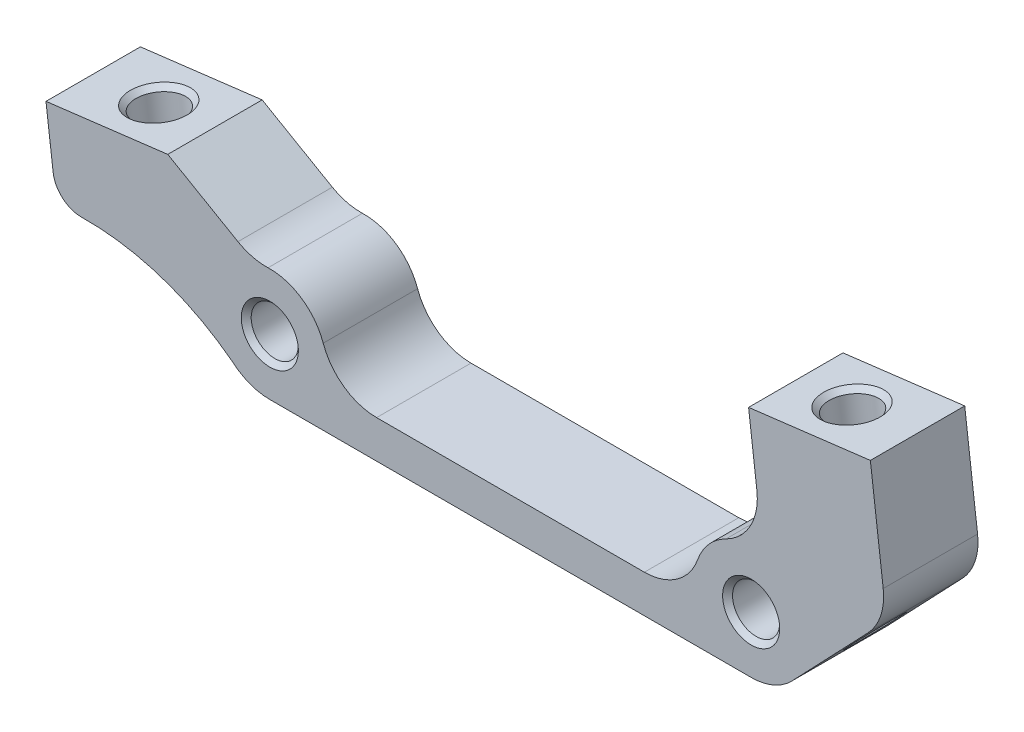
from build123d import *

# Parameters (mm, degrees)
SKETCH_1_R                  = 2.5
EXTRUDE_1_DEPTH             = 10
HOLE_WIZARD_M61_AT_2_COUNT  = 2
HOLE_WIZARD_M61_AT_2_PITCH  = 51
HOLE_WIZARD_M62_D           = 5
HOLE_WIZARD_M62_CSINK_D     = 6.05
HOLE_WIZARD_M62_CSINK_ANGLE = 90


with BuildPart() as part:
    # Эскиз1 → Бобышка-Вытянуть1 (new body)
    with BuildSketch(Plane.XY):
        with BuildLine():
            Line((130.883213409, -0.667537052), (132.243357005, -11.745017689))
            ThreePointArc((132.243357005, -11.745017689), (131.983826113, -14.362626415), (130.629567818, -16.617668809))
            Line((130.629567818, -16.617668809), (122.596022679, -25.039275591))
            ThreePointArc((122.596022679, -25.039275591), (120.615825879, -26.413663696), (118.254534957, -26.897840532))
            Line((118.254534957, -26.897840532), (67.254534957, -26.897840532))
            ThreePointArc((67.254534957, -26.897840532), (65.137379079, -26.511898867), (63.292589424, -25.403724196))
            ThreePointArc((63.292589424, -25.403724196), (55.75092202, -21.419041585), (47.318028666, -20.138123004))
            ThreePointArc((47.318028666, -20.138123004), (45.29848634, -19.402158499), (44.289626193, -17.504160563))
            Line((44.289626193, -17.504160563), (43.539152064, -11.392039271))
            Line((43.539152064, -11.392039271), (56.442252036, -9.807737807))
            Line((56.442252036, -9.807737807), (63.876575818, -14.099946644))
            ThreePointArc((63.876575818, -14.099946644), (65.415135622, -14.723089071), (67.065555387, -14.900817376))
            ThreePointArc((67.065555387, -14.900817376), (70.641046717, -15.944908259), (72.911389206, -18.897840532))
            ThreePointArc((72.911389206, -18.897840532), (75.10414184, -21.796820017), (78.568243456, -22.897840532))
            Line((78.568243456, -22.897840532), (106.940826458, -22.897840532))
            ThreePointArc((106.940826458, -22.897840532), (110.404928073, -21.796820017), (112.597680707, -18.897840532))
            ThreePointArc((112.597680707, -18.897840532), (113.760800632, -16.922120242), (115.58004554, -15.526890303))
            ThreePointArc((115.58004554, -15.526890303), (118.190187148, -12.997185387), (118.860833034, -9.424724013))
            Line((118.860833034, -9.424724013), (117.980113437, -2.251838516))
            Line((117.980113437, -2.251838516), (130.883213409, -0.667537052))
        make_face()
        with Locations((67.254534957, -20.897840532)):
            Circle(SKETCH_1_R, mode=Mode.SUBTRACT)
        with Locations((118.254534957, -20.897840532)):
            Circle(SKETCH_1_R, mode=Mode.SUBTRACT)
    extrude(amount=EXTRUDE_1_DEPTH)

    # Эскиз2 → Отверстие обработанное метчиком M61 (revolve, cut)
    with BuildSketch(Plane(origin=(67.254534957, -20.897840532, 10), x_dir=(0, -1, 0), z_dir=(1, 0, 0))):
        Polygon((0, 0), (0, 10), (3.025, 10), (2.5, 9.475), (2.5, 0.525), (3.025, 0), align=None)
    hole_wizard_m61 = revolve(axis=Axis((67.254534957, -20.897840532, 16.35), (0, 0, -1)), mode=Mode.SUBTRACT)

    # Отверстие обработанное метчиком M61 at 2: Отверстие обработанное метчиком M61 ×2
    with Locations(*[(i * HOLE_WIZARD_M61_AT_2_PITCH, 0, 0) for i in range(1, HOLE_WIZARD_M61_AT_2_COUNT)]):
        add(hole_wizard_m61, mode=Mode.SUBTRACT)

    # Отверстие обработанное метчиком M62 (through all)
    with Locations(Plane(origin=(2.024641313, -16.489380245, 0), x_dir=(-0.992546151641322, -0.12186934340514836, 0), z_dir=(-0.12186934340514835, 0.9925461516413219, 0))):
        with Locations((-48.826277481, 5), (-122.826277481, 5)):
            CounterSinkHole(HOLE_WIZARD_M62_D / 2, HOLE_WIZARD_M62_CSINK_D / 2, counter_sink_angle=HOLE_WIZARD_M62_CSINK_ANGLE)


solid = part.part
